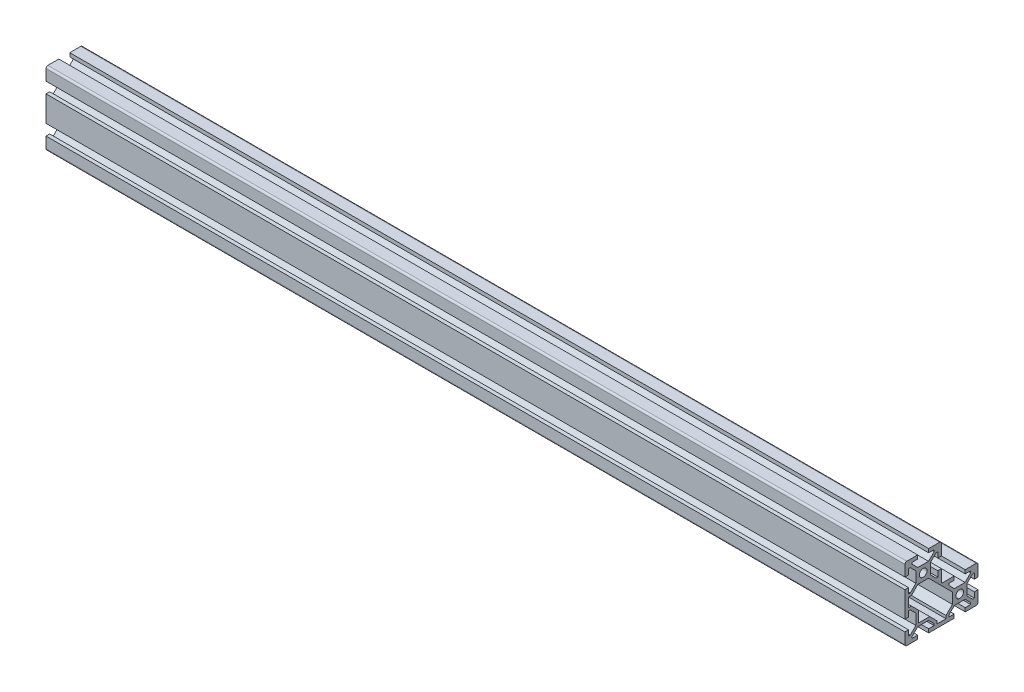
from build123d import *

# Parameters (mm, degrees)
SKETCH1_R           = 2.1
BOSS_EXTRUDE1_DEPTH = 470


with BuildPart() as part:
    # Sketch1 → Boss-Extrude1 (new body)
    with BuildSketch(Plane(origin=(0, 0, 0), x_dir=(0, 0, -1), z_dir=(1, 0, 0))):
        with BuildLine():
            Line((-13, 18), (-13, 20))
            Line((-13, 20), (-19, 20))
            ThreePointArc((-19, 20), (-19.707106781, 19.707106781), (-20, 19))
            Line((-20, 19), (-20, 13))
            Line((-20, 13), (-18, 13))
            Line((-18, 13), (-18, 16))
            Line((-18, 16), (-17.060660172, 16))
            Line((-17.060660172, 16), (-14, 12.939339828))
            Line((-14, 12.939339828), (-14, 7.060660172))
            Line((-14, 7.060660172), (-17.060660172, 4))
            Line((-17.060660172, 4), (-18, 4))
            Line((-18, 4), (-18, 7))
            Line((-18, 7), (-20, 7))
            Line((-20, 7), (-20, -7))
            Line((-20, -7), (-18, -7))
            Line((-18, -7), (-18, -4))
            Line((-18, -4), (-17.060660172, -4))
            Line((-17.060660172, -4), (-14, -7.060660172))
            Line((-14, -7.060660172), (-14, -12.939339828))
            Line((-14, -12.939339828), (-17.060660172, -16))
            Line((-17.060660172, -16), (-18, -16))
            Line((-18, -16), (-18, -13))
            Line((-18, -13), (-20, -13))
            Line((-20, -13), (-20, -19))
            ThreePointArc((-20, -19), (-19.707106781, -19.707106781), (-19, -20))
            Line((-19, -20), (-13, -20))
            Line((-13, -20), (-13, -18))
            Line((-13, -18), (-16, -18))
            Line((-16, -18), (-16, -17.060660172))
            Line((-16, -17.060660172), (-12.939339828, -14))
            Line((-12.939339828, -14), (-7.060660172, -14))
            Line((-7.060660172, -14), (-4, -17.060660172))
            Line((-4, -17.060660172), (-4, -18))
            Line((-4, -18), (-7, -18))
            Line((-7, -18), (-7, -20))
            Line((-7, -20), (7, -20))
            Line((7, -20), (7, -18))
            Line((7, -18), (4, -18))
            Line((4, -18), (4, -17.060660172))
            Line((4, -17.060660172), (7.060660172, -14))
            Line((7.060660172, -14), (12.939339828, -14))
            Line((12.939339828, -14), (16, -17.060660172))
            Line((16, -17.060660172), (16, -18))
            Line((16, -18), (13, -18))
            Line((13, -18), (13, -20))
            Line((13, -20), (19, -20))
            ThreePointArc((19, -20), (19.707106781, -19.707106781), (20, -19))
            Line((20, -19), (20, -13))
            Line((20, -13), (18, -13))
            Line((18, -13), (18, -16))
            Line((18, -16), (17.060660172, -16))
            Line((17.060660172, -16), (14, -12.939339828))
            Line((14, -12.939339828), (14, -7.060660172))
            Line((14, -7.060660172), (17.060660172, -4))
            Line((17.060660172, -4), (18, -4))
            Line((18, -4), (18, -7))
            Line((18, -7), (20, -7))
            Line((20, -7), (20, -1))
            ThreePointArc((20, -1), (19.707106781, -0.292893219), (19, 0))
            Line((19, 0), (13, 0))
            Line((13, 0), (13, -2))
            Line((13, -2), (16, -2))
            Line((16, -2), (16, -2.939339828))
            Line((16, -2.939339828), (12.939339828, -6))
            Line((12.939339828, -6), (7.060660172, -6))
            Line((7.060660172, -6), (4, -2.939339828))
            Line((4, -2.939339828), (4, -2))
            Line((4, -2), (7, -2))
            Line((7, -2), (7, 0))
            Line((7, 0), (0.3, 0))
            ThreePointArc((0.3, 0), (0.087867966, 0.087867966), (0, 0.3))
            Line((0, 0.3), (0, 7))
            Line((0, 7), (-2, 7))
            Line((-2, 7), (-2, 4))
            Line((-2, 4), (-2.939339828, 4))
            Line((-2.939339828, 4), (-6, 7.060660172))
            Line((-6, 7.060660172), (-6, 12.939339828))
            Line((-6, 12.939339828), (-2.939339828, 16))
            Line((-2.939339828, 16), (-2, 16))
            Line((-2, 16), (-2, 13))
            Line((-2, 13), (0, 13))
            Line((0, 13), (0, 19))
            ThreePointArc((0, 19), (-0.292893219, 19.707106781), (-1, 20))
            Line((-1, 20), (-7, 20))
            Line((-7, 20), (-7, 18))
            Line((-7, 18), (-4, 18))
            Line((-4, 18), (-4, 17.060660172))
            Line((-4, 17.060660172), (-7.060660172, 14))
            Line((-7.060660172, 14), (-12.939339828, 14))
            Line((-12.939339828, 14), (-16, 17.060660172))
            Line((-16, 17.060660172), (-16, 18))
            Line((-16, 18), (-13, 18))
        make_face()
        with Locations((10, -10)):
            Circle(SKETCH1_R, mode=Mode.SUBTRACT)
        with Locations((-10, 10)):
            Circle(SKETCH1_R, mode=Mode.SUBTRACT)
        Polygon((6, -7.060660172), (-7.060660172, 6), (-12.939339828, 6), (-16.439339828, 2.5), (-18, 2.5), (-18, -2.5), (-16.439339828, -2.5), (-12.5, -6.439339828), (-12.5, -12.5), (-6.439339828, -12.5), (-2.5, -16.439339828), (-2.5, -18), (2.5, -18), (2.5, -16.439339828), (6, -12.939339828), align=None, mode=Mode.SUBTRACT)
    extrude(amount=BOSS_EXTRUDE1_DEPTH)


solid = part.part
